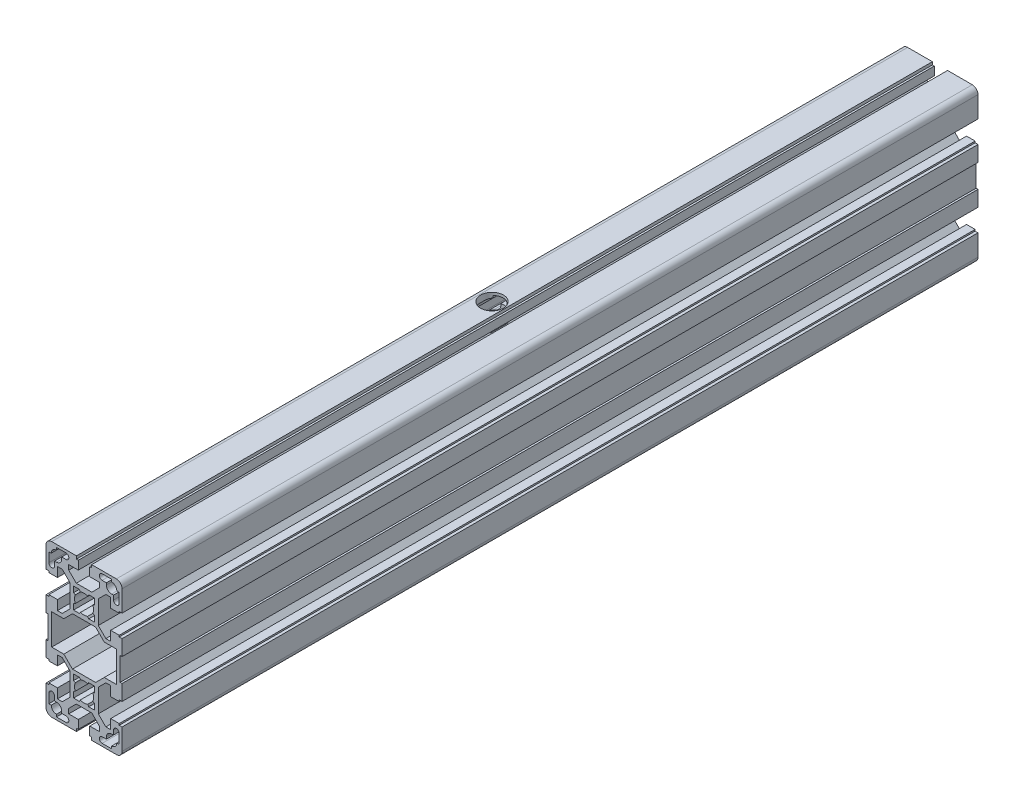
from build123d import *

# Parameters (mm, degrees)
EXTRUDE1_DEPTH     = 450
SKETCH2_R          = 6
CUT_EXTRUDE1_DEPTH = 10


with BuildPart() as part:
    # Sketch1 → Extrude1 (new body)
    with BuildSketch(Plane.XY):
        with BuildLine():
            Line((19, -6.108412677), (20, -6.108412677))
            Line((20, -6.108412677), (20, -14.308412677))
            Line((20, -14.308412677), (18.5, -14.308412677))
            Line((18.5, -14.308412677), (18.5, -15.108412677))
            Line((18.5, -15.108412677), (14, -15.108412677))
            Line((14, -15.108412677), (14, -10.058412677))
            Line((14, -10.058412677), (11.464213562, -10.058412677))
            Line((11.464213562, -10.058412677), (7.5, -14.02262624))
            Line((7.5, -14.02262624), (7.5, -26.194199115))
            Line((7.5, -26.194199115), (11.464213562, -30.158412677))
            Line((11.464213562, -30.158412677), (14, -30.158412677))
            Line((14, -30.158412677), (14, -25.108412677))
            Line((14, -25.108412677), (18.5, -25.108412677))
            Line((18.5, -25.108412677), (18.5, -25.908412677))
            Line((18.5, -25.908412677), (20, -25.908412677))
            Line((20, -25.908412677), (20, -37))
            ThreePointArc((20, -37), (19.121320344, -39.121320344), (17, -40))
            Line((17, -40), (4, -40))
            Line((4, -40), (4, -38.5))
            Line((4, -38.5), (3, -38.5))
            Line((3, -38.5), (3, -34))
            Line((3, -34), (8.05, -34))
            Line((8.05, -34), (8.05, -31.464213562))
            Line((8.05, -31.464213562), (4.085786438, -27.5))
            Line((4.085786438, -27.5), (-4.085786438, -27.5))
            Line((-4.085786438, -27.5), (-8.05, -31.464213562))
            Line((-8.05, -31.464213562), (-8.05, -34))
            Line((-8.05, -34), (-3, -34))
            Line((-3, -34), (-3, -38.5))
            Line((-3, -38.5), (-4, -38.5))
            Line((-4, -38.5), (-4, -40))
            Line((-4, -40), (-17, -40))
            ThreePointArc((-17, -40), (-19.121320344, -39.121320344), (-20, -37))
            Line((-20, -37), (-20, -25.908412677))
            Line((-20, -25.908412677), (-18.5, -25.908412677))
            Line((-18.5, -25.908412677), (-18.5, -25.108412677))
            Line((-18.5, -25.108412677), (-14, -25.108412677))
            Line((-14, -25.108412677), (-14, -30.158412677))
            Line((-14, -30.158412677), (-11.464213562, -30.158412677))
            Line((-11.464213562, -30.158412677), (-7.5, -26.194199115))
            Line((-7.5, -26.194199115), (-7.5, -14.02262624))
            Line((-7.5, -14.02262624), (-11.464213562, -10.058412677))
            Line((-11.464213562, -10.058412677), (-14, -10.058412677))
            Line((-14, -10.058412677), (-14, -15.108412677))
            Line((-14, -15.108412677), (-18.5, -15.108412677))
            Line((-18.5, -15.108412677), (-18.5, -14.308412677))
            Line((-18.5, -14.308412677), (-20, -14.308412677))
            Line((-20, -14.308412677), (-20, -6.108412677))
            Line((-20, -6.108412677), (-19, -6.108412677))
            Line((-19, -6.108412677), (-19, 6.108412677))
            Line((-19, 6.108412677), (-20, 6.108412677))
            Line((-20, 6.108412677), (-20, 14.308412677))
            Line((-20, 14.308412677), (-18.5, 14.308412677))
            Line((-18.5, 14.308412677), (-18.5, 15.108412677))
            Line((-18.5, 15.108412677), (-14, 15.108412677))
            Line((-14, 15.108412677), (-14, 10.058412677))
            Line((-14, 10.058412677), (-11.464213562, 10.058412677))
            Line((-11.464213562, 10.058412677), (-7.5, 14.02262624))
            Line((-7.5, 14.02262624), (-7.5, 26.194199115))
            Line((-7.5, 26.194199115), (-11.464213562, 30.158412677))
            Line((-11.464213562, 30.158412677), (-14, 30.158412677))
            Line((-14, 30.158412677), (-14, 25.108412677))
            Line((-14, 25.108412677), (-18.5, 25.108412677))
            Line((-18.5, 25.108412677), (-18.5, 25.908412677))
            Line((-18.5, 25.908412677), (-20, 25.908412677))
            Line((-20, 25.908412677), (-20, 37))
            ThreePointArc((-20, 37), (-19.121320344, 39.121320344), (-17, 40))
            Line((-17, 40), (-4, 40))
            Line((-4, 40), (-4, 38.5))
            Line((-4, 38.5), (-3, 38.5))
            Line((-3, 38.5), (-3, 34))
            Line((-3, 34), (-8.05, 34))
            Line((-8.05, 34), (-8.05, 31.464213562))
            Line((-8.05, 31.464213562), (-4.085786438, 27.5))
            Line((-4.085786438, 27.5), (4.085786438, 27.5))
            Line((4.085786438, 27.5), (8.05, 31.464213562))
            Line((8.05, 31.464213562), (8.05, 34))
            Line((8.05, 34), (3, 34))
            Line((3, 34), (3, 38.5))
            Line((3, 38.5), (4, 38.5))
            Line((4, 38.5), (4, 40))
            Line((4, 40), (17, 40))
            ThreePointArc((17, 40), (19.121320344, 39.121320344), (20, 37))
            Line((20, 37), (20, 25.908412677))
            Line((20, 25.908412677), (18.5, 25.908412677))
            Line((18.5, 25.908412677), (18.5, 25.108412677))
            Line((18.5, 25.108412677), (14, 25.108412677))
            Line((14, 25.108412677), (14, 30.158412677))
            Line((14, 30.158412677), (11.464213562, 30.158412677))
            Line((11.464213562, 30.158412677), (7.5, 26.194199115))
            Line((7.5, 26.194199115), (7.5, 14.02262624))
            Line((7.5, 14.02262624), (11.464213562, 10.058412677))
            Line((11.464213562, 10.058412677), (14, 10.058412677))
            Line((14, 10.058412677), (14, 15.108412677))
            Line((14, 15.108412677), (18.5, 15.108412677))
            Line((18.5, 15.108412677), (18.5, 14.308412677))
            Line((18.5, 14.308412677), (20, 14.308412677))
            Line((20, 14.308412677), (20, 6.108412677))
            Line((20, 6.108412677), (19, 6.108412677))
            Line((19, 6.108412677), (19, -6.108412677))
        make_face()
        Polygon((10.635786438, -8.058412677), (17, -8.058412677), (17, 8.058412677), (10.635786438, 8.058412677), (6.085786438, 12.608412677), (-6.085786438, 12.608412677), (-10.635786438, 8.058412677), (-17, 8.058412677), (-17, -8.058412677), (-10.635786438, -8.058412677), (-6.085786438, -12.608412677), (6.085786438, -12.608412677), align=None, mode=Mode.SUBTRACT)
        with BuildLine():
            Line((-18.5, -34.608412677), (-18.5, -29.608412677))
            ThreePointArc((-18.5, -29.608412677), (-17, -28.108412677), (-15.5, -29.608412677))
            Line((-15.5, -29.608412677), (-15.5, -31.858412677))
            Line((-15.5, -31.858412677), (-14.5, -31.858412677))
            ThreePointArc((-14.5, -31.858412677), (-12.555456352, -32.663869029), (-11.75, -34.608412677))
            Line((-11.75, -34.608412677), (-11.75, -35.608412677))
            Line((-11.75, -35.608412677), (-9.5, -35.608412677))
            ThreePointArc((-9.5, -35.608412677), (-8, -37.108412677), (-9.5, -38.608412677))
            Line((-9.5, -38.608412677), (-14.5, -38.608412677))
            Line((-14.5, -38.608412677), (-14.5, -37.358412677))
            ThreePointArc((-14.5, -37.358412677), (-16.444543648, -36.552956325), (-17.25, -34.608412677))
            Line((-17.25, -34.608412677), (-18.5, -34.608412677))
        make_face(mode=Mode.SUBTRACT)
        with BuildLine():
            Line((5.531462905, -14.538377291), (2.481473302, -14.538377291))
            Line((2.481473302, -14.538377291), (1.842845631, -15.351998281))
            ThreePointArc((1.842845631, -15.351998281), (0, -15), (-1.842845631, -15.351998281))
            Line((-1.842845631, -15.351998281), (-2.481473302, -14.538377291))
            Line((-2.481473302, -14.538377291), (-5.531462905, -14.538377291))
            Line((-5.531462905, -14.538377291), (-5.531462905, -17.588366894))
            Line((-5.531462905, -17.588366894), (-4.583333333, -18.001736865))
            ThreePointArc((-4.583333333, -18.001736865), (-4.999866175, -19.963418185), (-4.612081904, -21.930984338))
            Line((-4.612081904, -21.930984338), (-5.5, -22.461480212))
            Line((-5.5, -22.461480212), (-5.5, -25.511469815))
            Line((-5.5, -25.511469815), (-2.450010397, -25.511469815))
            Line((-2.450010397, -25.511469815), (-1.967151279, -24.596772329))
            ThreePointArc((-1.967151279, -24.596772329), (0, -25), (1.967151279, -24.596772329))
            Line((1.967151279, -24.596772329), (2.450010397, -25.511469815))
            Line((2.450010397, -25.511469815), (5.5, -25.511469815))
            Line((5.5, -25.511469815), (5.5, -22.461480212))
            Line((5.5, -22.461480212), (4.612081904, -21.930984338))
            ThreePointArc((4.612081904, -21.930984338), (4.999866175, -19.963418185), (4.583333333, -18.001736865))
            Line((4.583333333, -18.001736865), (5.531462905, -17.588366894))
            Line((5.531462905, -17.588366894), (5.531462905, -14.538377291))
        make_face(mode=Mode.SUBTRACT)
        with BuildLine():
            Line((15.5, -31.858412677), (14.5, -31.858412677))
            ThreePointArc((14.5, -31.858412677), (12.555456352, -32.663869029), (11.75, -34.608412677))
            Line((11.75, -34.608412677), (11.75, -35.608412677))
            Line((11.75, -35.608412677), (9.5, -35.608412677))
            ThreePointArc((9.5, -35.608412677), (8, -37.108412677), (9.5, -38.608412677))
            Line((9.5, -38.608412677), (14.5, -38.608412677))
            Line((14.5, -38.608412677), (14.5, -37.358412677))
            ThreePointArc((14.5, -37.358412677), (16.444543648, -36.552956325), (17.25, -34.608412677))
            Line((17.25, -34.608412677), (18.5, -34.608412677))
            Line((18.5, -34.608412677), (18.5, -29.608412677))
            ThreePointArc((18.5, -29.608412677), (17, -28.108412677), (15.5, -29.608412677))
            Line((15.5, -29.608412677), (15.5, -31.858412677))
        make_face(mode=Mode.SUBTRACT)
        with BuildLine():
            Line((18.5, 34.608412677), (18.5, 29.608412677))
            ThreePointArc((18.5, 29.608412677), (17, 28.108412677), (15.5, 29.608412677))
            Line((15.5, 29.608412677), (15.5, 31.858412677))
            Line((15.5, 31.858412677), (14.5, 31.858412677))
            ThreePointArc((14.5, 31.858412677), (12.555456352, 32.663869029), (11.75, 34.608412677))
            Line((11.75, 34.608412677), (11.75, 35.608412677))
            Line((11.75, 35.608412677), (9.5, 35.608412677))
            ThreePointArc((9.5, 35.608412677), (8, 37.108412677), (9.5, 38.608412677))
            Line((9.5, 38.608412677), (14.5, 38.608412677))
            Line((14.5, 38.608412677), (14.5, 37.358412677))
            ThreePointArc((14.5, 37.358412677), (16.444543648, 36.552956325), (17.25, 34.608412677))
            Line((17.25, 34.608412677), (18.5, 34.608412677))
        make_face(mode=Mode.SUBTRACT)
        with BuildLine():
            Line((-5.531462905, 14.538377291), (-2.481473302, 14.538377291))
            Line((-2.481473302, 14.538377291), (-1.842845631, 15.351998281))
            ThreePointArc((-1.842845631, 15.351998281), (0, 15), (1.842845631, 15.351998281))
            Line((1.842845631, 15.351998281), (2.481473302, 14.538377291))
            Line((2.481473302, 14.538377291), (5.531462905, 14.538377291))
            Line((5.531462905, 14.538377291), (5.531462905, 17.588366894))
            Line((5.531462905, 17.588366894), (4.583333333, 18.001736865))
            ThreePointArc((4.583333333, 18.001736865), (4.999866175, 19.963418185), (4.612081904, 21.930984338))
            Line((4.612081904, 21.930984338), (5.5, 22.461480212))
            Line((5.5, 22.461480212), (5.5, 25.511469815))
            Line((5.5, 25.511469815), (2.450010397, 25.511469815))
            Line((2.450010397, 25.511469815), (1.967151279, 24.596772329))
            ThreePointArc((1.967151279, 24.596772329), (0, 25), (-1.967151279, 24.596772329))
            Line((-1.967151279, 24.596772329), (-2.450010397, 25.511469815))
            Line((-2.450010397, 25.511469815), (-5.5, 25.511469815))
            Line((-5.5, 25.511469815), (-5.5, 22.461480212))
            Line((-5.5, 22.461480212), (-4.612081904, 21.930984338))
            ThreePointArc((-4.612081904, 21.930984338), (-4.999866175, 19.963418185), (-4.583333333, 18.001736865))
            Line((-4.583333333, 18.001736865), (-5.531462905, 17.588366894))
            Line((-5.531462905, 17.588366894), (-5.531462905, 14.538377291))
        make_face(mode=Mode.SUBTRACT)
        with BuildLine():
            Line((-15.5, 31.858412677), (-14.5, 31.858412677))
            ThreePointArc((-14.5, 31.858412677), (-12.555456352, 32.663869029), (-11.75, 34.608412677))
            Line((-11.75, 34.608412677), (-11.75, 35.608412677))
            Line((-11.75, 35.608412677), (-9.5, 35.608412677))
            ThreePointArc((-9.5, 35.608412677), (-8, 37.108412677), (-9.5, 38.608412677))
            Line((-9.5, 38.608412677), (-14.5, 38.608412677))
            Line((-14.5, 38.608412677), (-14.5, 37.358412677))
            ThreePointArc((-14.5, 37.358412677), (-16.444543648, 36.552956325), (-17.25, 34.608412677))
            Line((-17.25, 34.608412677), (-18.5, 34.608412677))
            Line((-18.5, 34.608412677), (-18.5, 29.608412677))
            ThreePointArc((-18.5, 29.608412677), (-17, 28.108412677), (-15.5, 29.608412677))
            Line((-15.5, 29.608412677), (-15.5, 31.858412677))
        make_face(mode=Mode.SUBTRACT)
    extrude(amount=-EXTRUDE1_DEPTH)

    # Sketch2 → Cut-Extrude1 (cut)
    with BuildSketch(Plane(origin=(0, 40, 0), x_dir=(1, 0, 0), z_dir=(0, 1, 0))):
        with Locations(Location((-10.5, 225, 0), (0, 0, 270))):
            Circle(SKETCH2_R)
    extrude(amount=-CUT_EXTRUDE1_DEPTH, mode=Mode.SUBTRACT)


solid = part.part
